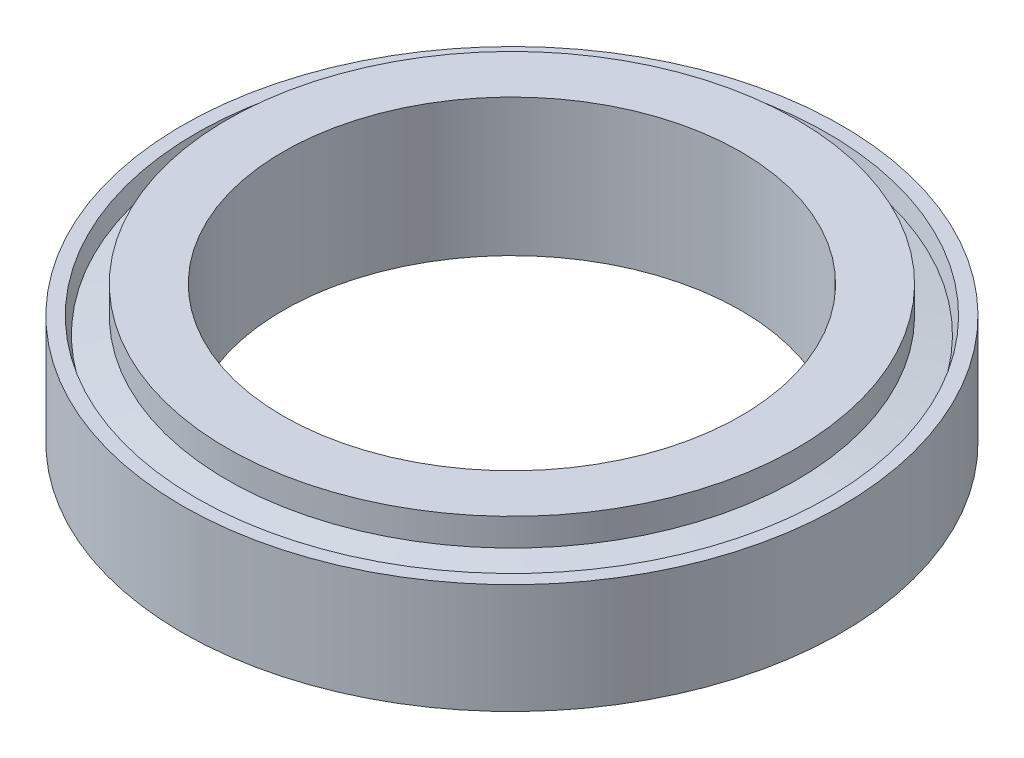
from build123d import *


with BuildPart() as part:
    # Skizze1 → Rotation1 (revolve)
    with BuildSketch(Plane.XY, mode=Mode.PRIVATE) as rotation1_sk:
        Polygon((32, 0), (36, 0), (36, 12), (34.5, 12), align=None)
    revolve(rotation1_sk.sketch.rotate(Axis((0, 0, 0), (0, -1, 0)), 90), axis=Axis((0, 0, 0), (0, -1, 0)))


with BuildPart() as body_2:
    # Skizze4 → Rotation2 (revolve)
    with BuildSketch(Plane.XY, mode=Mode.PRIVATE) as rotation2_sk:
        Polygon((26.5, 0), (25, 0), (25, 15), (31.1, 15), (31.1, 12), (28.6, 12), align=None)
    revolve(rotation2_sk.sketch.rotate(Axis((0, 0, 0), (0, 1, 0)), 90), axis=Axis((0, 0, 0), (0, 1, 0)))


with BuildPart() as body_3:
    # Skizze5 → Rotation3 (revolve)
    with BuildSketch(Plane.XY, mode=Mode.PRIVATE) as rotation3_sk:
        Polygon((32.041793551, 0.377136413), (26.74567254, 1.308546655), (28.477177317, 11.154110311), (34.02778686, 10.177944062), align=None)
    revolve(rotation3_sk.sketch.rotate(Axis((0, 0, 0), (0, -1, 0)), 90), axis=Axis((0, 0, 0), (0, -1, 0)))


solid = Compound([part.part, body_2.part, body_3.part])
